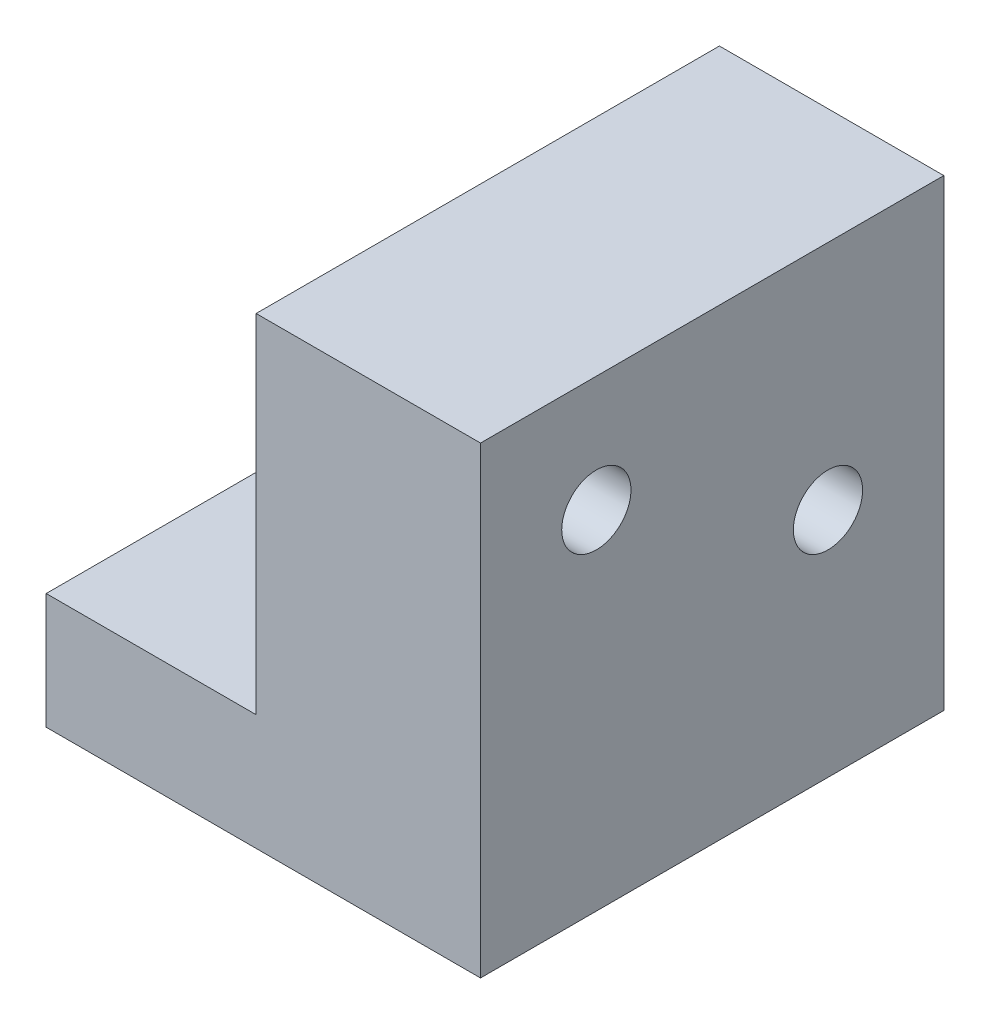
from build123d import *

# Parameters (mm, degrees)
SKETCH1_W              = 25.4
SKETCH1_H              = 25.4
EXTRUDE1_DEPTH         = 23.8125
SKETCH2_W              = 11.509375
SKETCH2_H              = 19.05
EXTRUDE2_DEPTH         = 38.060560658
F_10_24_TAPPED_HOLE1_D = 3.7973


with BuildPart() as part:
    # Sketch1 → Extrude1 (new body)
    with BuildSketch(Plane(origin=(0, 0, 0), x_dir=(0, 0, -1), z_dir=(1, 0, 0))):
        Rectangle(SKETCH1_W, SKETCH1_H)
    extrude(amount=-EXTRUDE1_DEPTH)

    # Sketch2 → Extrude2 (cut, through all)
    with BuildSketch(Plane.XY.offset(12.7)):
        with Locations((-18.0578125, 3.175)):
            Rectangle(SKETCH2_W, SKETCH2_H)
    extrude(amount=-EXTRUDE2_DEPTH, mode=Mode.SUBTRACT)

    # #10-24 Tapped Hole1 (through all)
    with Locations(Plane(origin=(-23.8125, 0.158049728, -0.576860853), x_dir=(0, 0, -1), z_dir=(-1, 0, 0))):
        with Locations((5.773139147, 0.158049728), (-6.926860853, -6.191950272)):
            Hole(F_10_24_TAPPED_HOLE1_D / 2)


solid = part.part
